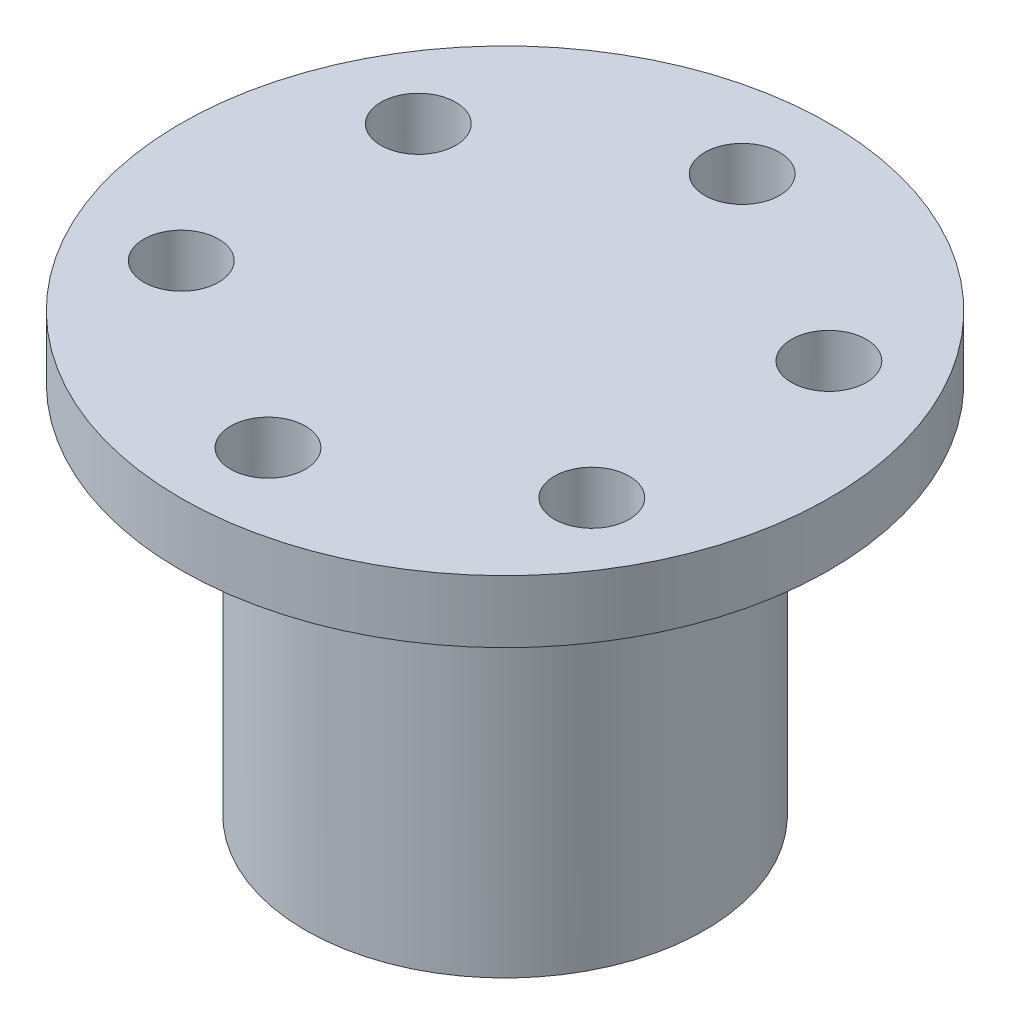
from build123d import *

# Parameters (mm, degrees)
SKETCH1_R           = 26
BOSS_EXTRUDE1_DEPTH = 5
SKETCH11_R          = 3
CUT_EXTRUDE7_DEPTH  = 38.107950631
BOSS_EXTRUDE4_START = -5
SKETCH4_R           = 16
BOSS_EXTRUDE4_DEPTH = 30
SKETCH10_W          = 18
SKETCH10_H          = 18
CUT_EXTRUDE8_DEPTH  = 24.25


with BuildPart() as part:
    # Sketch1 → Boss-Extrude1 (new body)
    with BuildSketch(Plane(origin=(0, 0, 0), x_dir=(1, 0, 0), z_dir=(0, 1, 0))):
        with Locations(Location((0, 0, 0), (0, 0, 270))):
            Circle(SKETCH1_R)
    extrude(amount=BOSS_EXTRUDE1_DEPTH)

    # Sketch11 → Cut-Extrude7 (cut, through all)
    with BuildSketch(Plane(origin=(0, 5, 0), x_dir=(1, 0, 0), z_dir=(0, 1, 0))):
        with Locations(Location((-16.454482672, -9.5, 0), (0, 0, 270))):
            Circle(SKETCH11_R)
        with Locations(Location((-16.454482672, 9.5, 0), (0, 0, 270))):
            Circle(SKETCH11_R)
        with Locations(Location((0, 19, 0), (0, 0, 270))):
            Circle(SKETCH11_R)
        with Locations(Location((16.454482672, 9.5, 0), (0, 0, 270))):
            Circle(SKETCH11_R)
        with Locations(Location((16.454482672, -9.5, 0), (0, 0, 270))):
            Circle(SKETCH11_R)
        with Locations(Location((0, -19, 0), (0, 0, 270))):
            Circle(SKETCH11_R)
    extrude(amount=-CUT_EXTRUDE7_DEPTH, mode=Mode.SUBTRACT)

    # Sketch4 → Boss-Extrude4 (add)
    with BuildSketch(Plane(origin=(0, 5, 0), x_dir=(1, 0, 0), z_dir=(0, 1, 0)).offset(BOSS_EXTRUDE4_START)):
        with Locations(Location((0, 0, 0), (0, 0, 270))):
            Circle(SKETCH4_R)
    extrude(amount=-BOSS_EXTRUDE4_DEPTH)

    # Sketch10 → Cut-Extrude8 (cut)
    with BuildSketch(Plane.XZ.offset(30)):
        Rectangle(SKETCH10_W, SKETCH10_H)
    extrude(amount=-CUT_EXTRUDE8_DEPTH, mode=Mode.SUBTRACT)


solid = part.part
